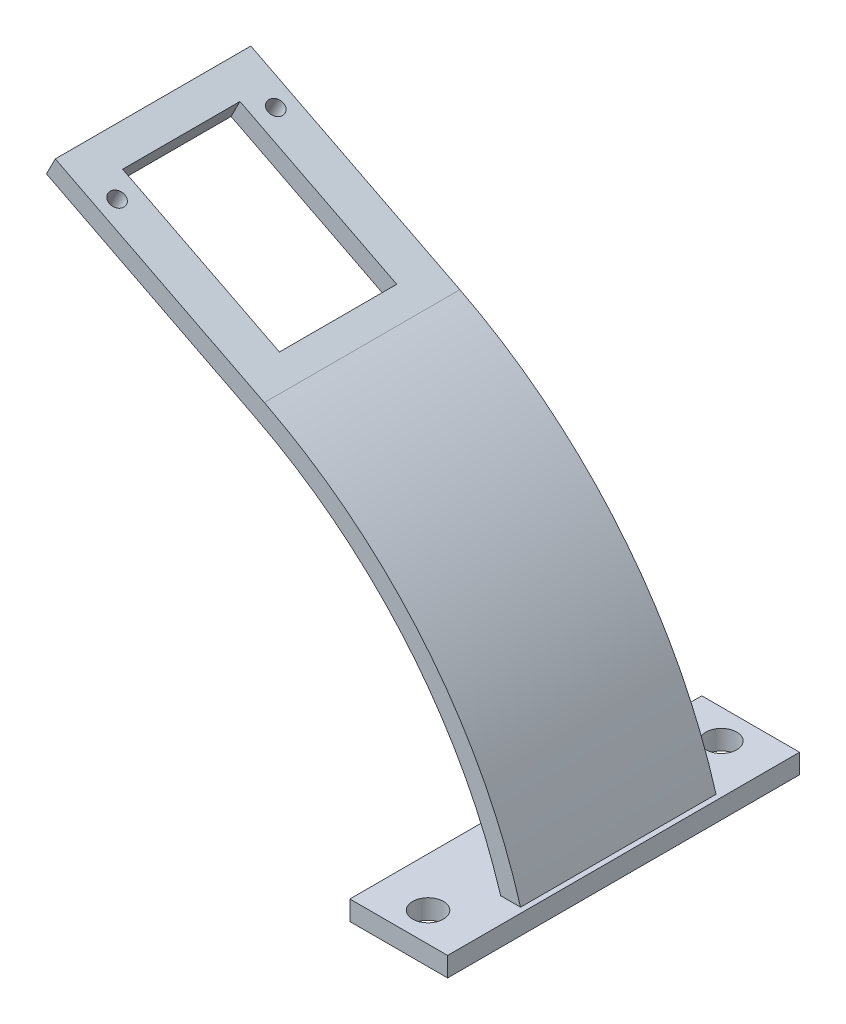
from build123d import *

# Parameters (mm, degrees)
BOSS_EXTRUDE1_DEPTH = 25.4
CUT_EXTRUDE1_REACH  = 84.87
SKETCH2_R           = 0.99949
SKETCH2_W           = 22.86
SKETCH2_H           = 15.24
SKETCH3_W           = 12.7
SKETCH3_H           = 45.72
SKETCH3_R           = 2
BOSS_EXTRUDE2_DEPTH = 2.54


with BuildPart() as part:
    # Sketch1 → Boss-Extrude1 (new body)
    with BuildSketch(Plane.XY):
        with BuildLine():
            Line((-32.578270726, 40.408843429), (-59.736149583, 54.246473861))
            Line((-59.736149583, 54.246473861), (-58.583013714, 56.509630432))
            Line((-58.583013714, 56.509630432), (-31.425134857, 42.672))
            ThreePointArc((-31.425134857, 42.672), (-9.813641153, 25.020432537), (2.54, 0))
            Line((2.54, 0), (0, 0))
            ThreePointArc((0, 0), (-11.97175713, 23.685162685), (-32.578270726, 40.408843429))
        make_face()
    extrude(amount=BOSS_EXTRUDE1_DEPTH)

    # Sketch2 → Cut-Extrude1 (cut, up to next)
    with BuildSketch(Plane(origin=(10.784234574, 21.165252068, 0), x_dir=(0.8910065241883675, -0.45399049973954775, 0), z_dir=(0.45399049973954775, 0.8910065241883675, 0)), mode=Mode.PRIVATE) as cut_extrude1_sk1:
        with Locations(Location((-71.502682786, -2.41681, 0), (0, 0, 180))):
            Circle(SKETCH2_R)
    cut_extrude1_tool1 = extrude(cut_extrude1_sk1.sketch, amount=-CUT_EXTRUDE1_REACH, mode=Mode.PRIVATE) & part.part
    # Sketch2 → Cut-Extrude1 (cut, up to next)
    with BuildSketch(Plane(origin=(10.784234574, 21.165252068, 0), x_dir=(0.8910065241883675, -0.45399049973954775, 0), z_dir=(0.45399049973954775, 0.8910065241883675, 0)), mode=Mode.PRIVATE) as cut_extrude1_sk2:
        with Locations(Location((-71.502682786, -23.03399, 0), (0, 0, 180))):
            Circle(SKETCH2_R)
    cut_extrude1_tool2 = extrude(cut_extrude1_sk2.sketch, amount=-CUT_EXTRUDE1_REACH, mode=Mode.PRIVATE) & part.part
    # Sketch2 → Cut-Extrude1 (cut, up to next)
    with BuildSketch(Plane(origin=(10.784234574, 21.165252068, 0), x_dir=(0.8910065241883675, -0.45399049973954775, 0), z_dir=(0.45399049973954775, 0.8910065241883675, 0)), mode=Mode.PRIVATE) as cut_extrude1_sk3:
        with Locations((-62.307882786, -12.7)):
            Rectangle(SKETCH2_W, SKETCH2_H)
    cut_extrude1_tool3 = extrude(cut_extrude1_sk3.sketch, amount=-CUT_EXTRUDE1_REACH, mode=Mode.PRIVATE) & part.part
    add(cut_extrude1_tool1.solids().sort_by_distance((-52.925122, 53.626791, 2.41681))[0], mode=Mode.SUBTRACT)
    add(cut_extrude1_tool2.solids().sort_by_distance((-52.925122, 53.626791, 23.03399))[0], mode=Mode.SUBTRACT)
    add(cut_extrude1_tool3.solids().sort_by_distance((-44.732495, 49.452439, 12.7))[0], mode=Mode.SUBTRACT)

    # Sketch3 → Boss-Extrude2 (add)
    with BuildSketch(Plane(origin=(0, 0, 0), x_dir=(1, 0, 0), z_dir=(0, 1, 0))):
        with Locations((-3.81, -12.7)):
            Rectangle(SKETCH3_W, SKETCH3_H)
        with Locations(Location((-3.81, 6.35, 0), (0, 0, 270))):
            Circle(SKETCH3_R, mode=Mode.SUBTRACT)
        with Locations(Location((-3.81, -31.75, 0), (0, 0, 270))):
            Circle(SKETCH3_R, mode=Mode.SUBTRACT)
    extrude(amount=BOSS_EXTRUDE2_DEPTH)


solid = part.part
